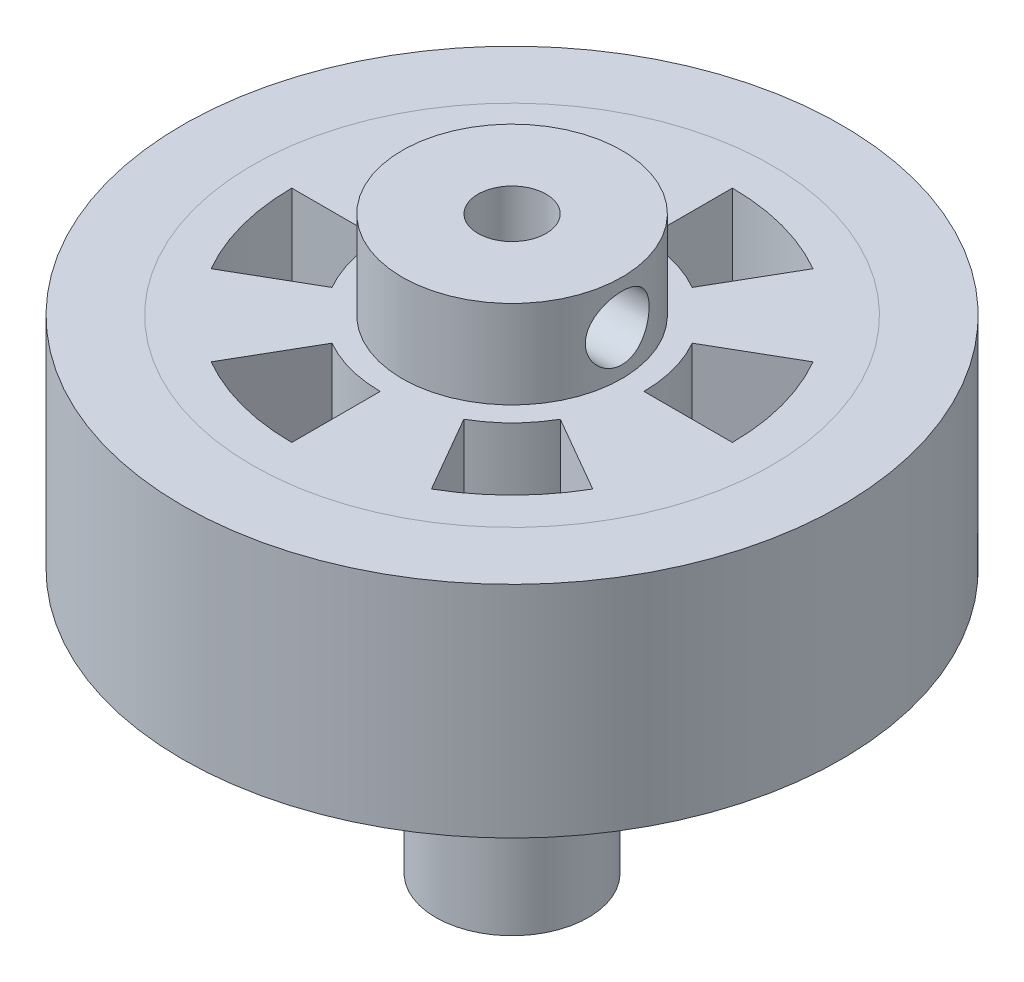
from build123d import *

# Parameters (mm, degrees)
SKETCH1_R               = 11.825
BOSS_EXTRUDE1_DEPTH     = 5
BOSS_EXTRUDE2_START     = 5
SKETCH2_R               = 5
BOSS_EXTRUDE2_DEPTH     = 4
SKETCH3_R               = 1.45
CUT_EXTRUDE1_DEPTH      = 5
CUT_EXTRUDE2_START      = 9
SKETCH4_R               = 1.55
CUT_EXTRUDE2_DEPTH      = 10
CUT_EXTRUDE3_DEPTH      = 19.991083481
CUT_EXTRUDE3_DEPTH_BACK = 19.991083481
BOSS_EXTRUDE4_START     = -5
SKETCH8_R               = 3.475
BOSS_EXTRUDE4_DEPTH     = 12
CHAMFER1_SIZE           = 2
BOSS_EXTRUDE5_START     = -5
SKETCH9_R               = 15
SKETCH9_R_2             = 11.825
BOSS_EXTRUDE5_DEPTH     = 10


with BuildPart() as part:
    # Sketch1 → Boss-Extrude1 (new, symmetric)
    with BuildSketch(Plane(origin=(0, 0, 0), x_dir=(1, 0, 0), z_dir=(0, 1, 0))):
        with Locations(Location((0, 0, 0), (0, 0, 270))):
            Circle(SKETCH1_R)
    extrude(amount=BOSS_EXTRUDE1_DEPTH, both=True)

    # Sketch2 → Boss-Extrude2 (add)
    with BuildSketch(Plane(origin=(0, 0, 0), x_dir=(1, 0, 0), z_dir=(0, 1, 0)).offset(BOSS_EXTRUDE2_START)):
        with Locations(Location((0, 0, 0), (0, 0, 270))):
            Circle(SKETCH2_R)
    extrude(amount=BOSS_EXTRUDE2_DEPTH)

    # Sketch3 → Cut-Extrude1 (cut)
    with BuildSketch(Plane(origin=(0, 0, 0), x_dir=(0, 0, -1), z_dir=(1, 0, 0))):
        with Locations(Location((0, 7, 0), (0, 0, 270))):
            Circle(SKETCH3_R)
    extrude(amount=CUT_EXTRUDE1_DEPTH, mode=Mode.SUBTRACT)

    # Sketch4 → Cut-Extrude2 (cut)
    with BuildSketch(Plane(origin=(0, 0, 0), x_dir=(1, 0, 0), z_dir=(0, 1, 0)).offset(CUT_EXTRUDE2_START)):
        with Locations(Location((0, 0, 0), (0, 0, 270))):
            Circle(SKETCH4_R)
    extrude(amount=-CUT_EXTRUDE2_DEPTH, mode=Mode.SUBTRACT)

    # Sketch6 → Cut-Extrude3 (cut, two sides: drawn at the far end of the back side and taken through both)
    with BuildSketch(Plane(origin=(0, 0, 0), x_dir=(1, 0, 0), z_dir=(0, 1, 0)).offset(-CUT_EXTRUDE3_DEPTH_BACK)):
        with BuildLine():
            Line((0, 6), (0, 10.027433571))
            ThreePointArc((0, 10.027433571), (2.595290782, 9.685757057), (5.013716785, 8.684012207))
            Line((5.013716785, 8.684012207), (3, 5.196152423))
            ThreePointArc((3, 5.196152423), (1.552914271, 5.795554958), (0, 6))
        make_face()
        with BuildLine():
            Line((5.196152423, 3), (8.684012207, 5.013716785))
            ThreePointArc((8.684012207, 5.013716785), (9.685757057, 2.595290782), (10.027433571, 0))
            Line((10.027433571, 0), (6, 0))
            ThreePointArc((6, 0), (5.795554958, 1.552914271), (5.196152423, 3))
        make_face()
        with BuildLine():
            Line((5.196152423, -3), (8.684012207, -5.013716785))
            ThreePointArc((8.684012207, -5.013716785), (7.090466276, -7.090466276), (5.013716785, -8.684012207))
            Line((5.013716785, -8.684012207), (3, -5.196152423))
            ThreePointArc((3, -5.196152423), (4.242640687, -4.242640687), (5.196152423, -3))
        make_face()
        with BuildLine():
            Line((0, -6), (0, -10.027433571))
            ThreePointArc((0, -10.027433571), (-2.595290782, -9.685757057), (-5.013716785, -8.684012207))
            Line((-5.013716785, -8.684012207), (-3, -5.196152423))
            ThreePointArc((-3, -5.196152423), (-1.552914271, -5.795554958), (0, -6))
        make_face()
        with BuildLine():
            Line((-5.196152423, -3), (-8.684012207, -5.013716785))
            ThreePointArc((-8.684012207, -5.013716785), (-9.685757057, -2.595290782), (-10.027433571, 0))
            Line((-10.027433571, 0), (-6, 0))
            ThreePointArc((-6, 0), (-5.795554958, -1.552914271), (-5.196152423, -3))
        make_face()
        with BuildLine():
            Line((-5.196152423, 3), (-8.684012207, 5.013716785))
            ThreePointArc((-8.684012207, 5.013716785), (-7.090466276, 7.090466276), (-5.013716785, 8.684012207))
            Line((-5.013716785, 8.684012207), (-3, 5.196152423))
            ThreePointArc((-3, 5.196152423), (-4.242640687, 4.242640687), (-5.196152423, 3))
        make_face()
    extrude(amount=CUT_EXTRUDE3_DEPTH + CUT_EXTRUDE3_DEPTH_BACK, mode=Mode.SUBTRACT)

    # Sketch8 → Boss-Extrude4 (add)
    with BuildSketch(Plane(origin=(0, 0, 0), x_dir=(1, 0, 0), z_dir=(0, 1, 0)).offset(BOSS_EXTRUDE4_START)):
        with Locations(Location((0, 0, 0), (0, 0, 270))):
            Circle(SKETCH8_R)
    extrude(amount=-BOSS_EXTRUDE4_DEPTH)

    # Chamfer1
    chamfer1_edges = [part.edges().sort_by_distance(p)[0] for p in [
        (0, -5, -3.475),
    ]]
    chamfer(chamfer1_edges, length=CHAMFER1_SIZE)


with BuildPart() as body_2:
    # Sketch9 → Boss-Extrude5 (new body)
    with BuildSketch(Plane(origin=(0, 0, 0), x_dir=(1, 0, 0), z_dir=(0, 1, 0)).offset(BOSS_EXTRUDE5_START)):
        with Locations(Location((0, 0, 0), (0, 0, 270))):
            Circle(SKETCH9_R)
        with Locations(Location((0, 0, 0), (0, 0, 270))):
            Circle(SKETCH9_R_2, mode=Mode.SUBTRACT)
    extrude(amount=BOSS_EXTRUDE5_DEPTH)


solid = Compound([part.part, body_2.part])
